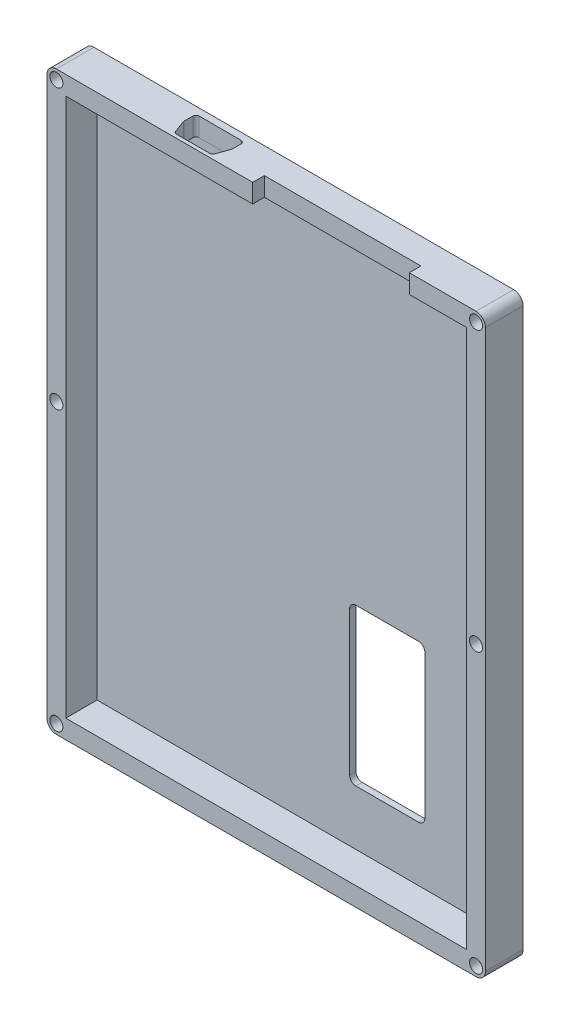
from build123d import *

# Parameters (mm, degrees)
BOSS_EXTRUDE1_DEPTH       = 1
BOSS_EXTRUDE2_DEPTH       = 5
BOSS_EXTRUDE3_DEPTH       = 5
CUT_EXTRUDE3_DEPTH        = 10
CUT_EXTRUDE2_DEPTH        = 10
TAP_DRILL_FOR_3_56_TAP1_D = 2.0828
SKETCH29_W                = 25
SKETCH29_H                = 1.864988104
CUT_EXTRUDE4_DEPTH        = 10


with BuildPart() as part:
    # Sketch2 → Boss-Extrude1 (new body)
    with BuildSketch(Plane.XY):
        with BuildLine():
            Line((-33.5, 46), (33.5, 46))
            ThreePointArc((33.5, 46), (34.560660172, 45.560660172), (35, 44.5))
            Line((35, 44.5), (35, -44.5))
            ThreePointArc((35, -44.5), (34.560660172, -45.560660172), (33.5, -46))
            Line((33.5, -46), (-33.5, -46))
            ThreePointArc((-33.5, -46), (-34.560660172, -45.560660172), (-35, -44.5))
            Line((-35, -44.5), (-35, 44.5))
            ThreePointArc((-35, 44.5), (-34.560660172, 45.560660172), (-33.5, 46))
        make_face()
    extrude(amount=BOSS_EXTRUDE1_DEPTH)

    # Sketch3 → Boss-Extrude2 (add)
    with BuildSketch(Plane.XY.offset(1)):
        with BuildLine():
            Line((-32, 44.5), (-32, -44.5))
            ThreePointArc((-32, -44.5), (-33.5, -46), (-35, -44.5))
            Line((-35, -44.5), (-35, 44.5))
            ThreePointArc((-35, 44.5), (-33.5, 46), (-32, 44.5))
        make_face()
        with BuildLine():
            Line((32, 44.5), (32, -44.5))
            ThreePointArc((32, -44.5), (33.5, -46), (35, -44.5))
            Line((35, -44.5), (35, 44.5))
            ThreePointArc((35, 44.5), (33.5, 46), (32, 44.5))
        make_face()
    extrude(amount=BOSS_EXTRUDE2_DEPTH)

    # Sketch4 → Boss-Extrude3 (add)
    with BuildSketch(Plane.XY.offset(1)):
        with BuildLine():
            Line((-33.5, 46), (33.5, 46))
            ThreePointArc((33.5, 46), (35, 44.5), (33.5, 43))
            Line((33.5, 43), (-33.5, 43))
            ThreePointArc((-33.5, 43), (-35, 44.5), (-33.5, 46))
        make_face()
        with BuildLine():
            Line((-33.5, -46), (33.5, -46))
            ThreePointArc((33.5, -46), (35, -44.5), (33.5, -43))
            Line((33.5, -43), (-33.5, -43))
            ThreePointArc((-33.5, -43), (-35, -44.5), (-33.5, -46))
        make_face()
    extrude(amount=BOSS_EXTRUDE3_DEPTH)

    # Sketch5 → Cut-Extrude3 (cut)
    with BuildSketch(Plane(origin=(0, 46, 0), x_dir=(1, 0, 0), z_dir=(0, 1, 0))):
        with BuildLine():
            ThreePointArc((-14.89567412, -5.42869642), (-15.182613275, -5.338166714), (-15.36564636, -5.099360107))
            Line((-15.36564636, -5.099360107), (-16.066024836, -3.170663686))
            ThreePointArc((-16.066024836, -3.170663686), (-16.088488439, -3.0866426), (-16.096052596, -3))
            Line((-16.096052596, -3), (-16.096052596, -1.612708973))
            ThreePointArc((-16.096052596, -1.612708973), (-15.949605986, -1.259155582), (-15.596052596, -1.112708973))
            Line((-15.596052596, -1.112708973), (-8.896052596, -1.112708973))
            ThreePointArc((-8.896052596, -1.112708973), (-8.542499205, -1.259155582), (-8.396052596, -1.612708973))
            Line((-8.396052596, -1.612708973), (-8.396052596, -3))
            ThreePointArc((-8.396052596, -3), (-8.403616752, -3.0866426), (-8.426080356, -3.170663686))
            Line((-8.426080356, -3.170663686), (-9.126458831, -5.099360107))
            ThreePointArc((-9.126458831, -5.099360107), (-9.309491917, -5.338166714), (-9.596431071, -5.42869642))
            Line((-9.596431071, -5.42869642), (-14.89567412, -5.42869642))
        make_face()
    extrude(amount=-CUT_EXTRUDE3_DEPTH, mode=Mode.SUBTRACT)

    # Sketch7 → Cut-Extrude2 (cut)
    with BuildSketch(Plane(origin=(0, 0, 0), x_dir=(-1, 0, 0), z_dir=(0, 0, -1))):
        with BuildLine():
            Line((-19.322853535, -9.222931336), (-9.322853535, -9.222931336))
            ThreePointArc((-9.322853535, -9.222931336), (-8.615746754, -9.515824554), (-8.322853535, -10.222931336))
            Line((-8.322853535, -10.222931336), (-8.322853535, -33.222931336))
            ThreePointArc((-8.322853535, -33.222931336), (-8.615746754, -33.930038117), (-9.322853535, -34.222931336))
            Line((-9.322853535, -34.222931336), (-19.322853535, -34.222931336))
            ThreePointArc((-19.322853535, -34.222931336), (-20.029960316, -33.930038117), (-20.322853535, -33.222931336))
            Line((-20.322853535, -33.222931336), (-20.322853535, -10.222931336))
            ThreePointArc((-20.322853535, -10.222931336), (-20.029960316, -9.515824554), (-19.322853535, -9.222931336))
        make_face()
    extrude(amount=-CUT_EXTRUDE2_DEPTH, mode=Mode.SUBTRACT)

    # Tap Drill for #3-56 Tap1 (through all)
    with Locations(Plane.XY.offset(6)):
        with Locations((-33.5, 44.5), (-33.5, 0), (-33.5, -44.5), (33.5, -44.5), (33.499705774, 0), (33.5, 44.5)):
            Hole(TAP_DRILL_FOR_3_56_TAP1_D / 2)

    # Sketch29 → Cut-Extrude4 (cut)
    with BuildSketch(Plane(origin=(0, 46, 0), x_dir=(1, 0, 0), z_dir=(0, 1, 0))):
        with Locations((10.342588325, -5.067505948)):
            Rectangle(SKETCH29_W, SKETCH29_H)
    extrude(amount=-CUT_EXTRUDE4_DEPTH, mode=Mode.SUBTRACT)


solid = part.part
